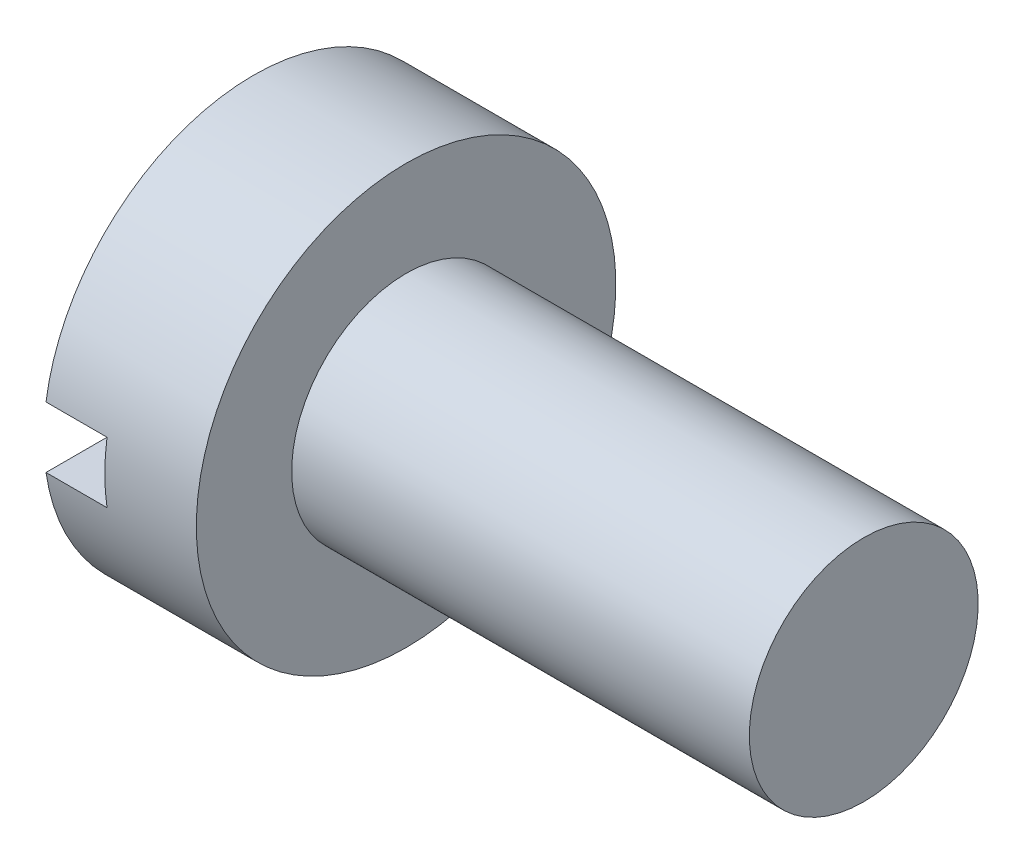
from build123d import *

# Parameters (mm, degrees)
SKETCH2_W          = 5.5
SKETCH2_H          = 0.8
CUT_EXTRUDE1_DEPTH = 0.8


with BuildPart() as part:
    # Sketch1 → Revolve1 (revolve)
    with BuildSketch(Plane.XY):
        Polygon((0, 0), (0, 2.75), (2, 2.75), (2, 1.5), (8, 1.5), (8, 0), align=None)
    revolve(axis=Axis((8, 0, 0), (-1, 0, 0)))

    # Sketch2 → Cut-Extrude1 (cut)
    with BuildSketch(Plane.ZY):
        Rectangle(SKETCH2_W, SKETCH2_H)
    extrude(amount=-CUT_EXTRUDE1_DEPTH, mode=Mode.SUBTRACT)


solid = part.part
